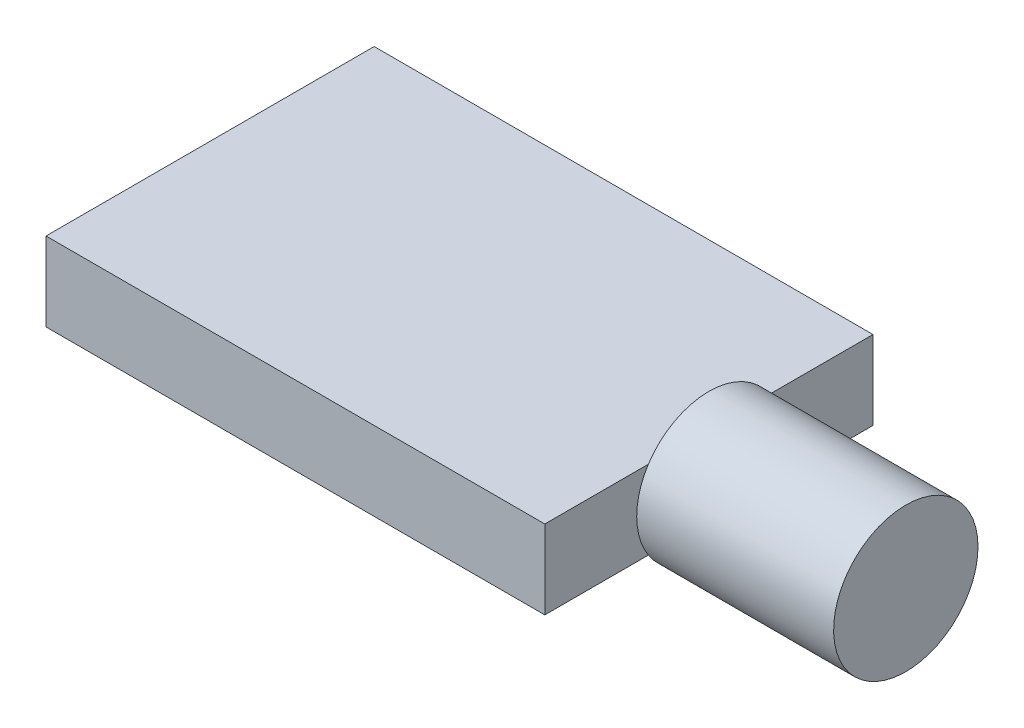
from build123d import *

# Parameters (mm, degrees)
SKETCH2_W           = 38
SKETCH2_H           = 25
BOSS_EXTRUDE1_DEPTH = 6
SKETCH3_R           = 5.5
BOSS_EXTRUDE2_DEPTH = 15


with BuildPart() as part:
    # Sketch2 → Boss-Extrude1 (new body)
    with BuildSketch(Plane(origin=(0, 0, 0), x_dir=(1, 0, 0), z_dir=(0, 1, 0))):
        Rectangle(SKETCH2_W, SKETCH2_H)
    extrude(amount=BOSS_EXTRUDE1_DEPTH)

    # Sketch3 → Boss-Extrude2 (add)
    with BuildSketch(Plane(origin=(19, 0, 0), x_dir=(0, 0, -1), z_dir=(1, 0, 0))):
        with Locations(Location((0, 3, 0), (0, 0, 146.944268849))):
            Circle(SKETCH3_R)
    extrude(amount=BOSS_EXTRUDE2_DEPTH)


solid = part.part
